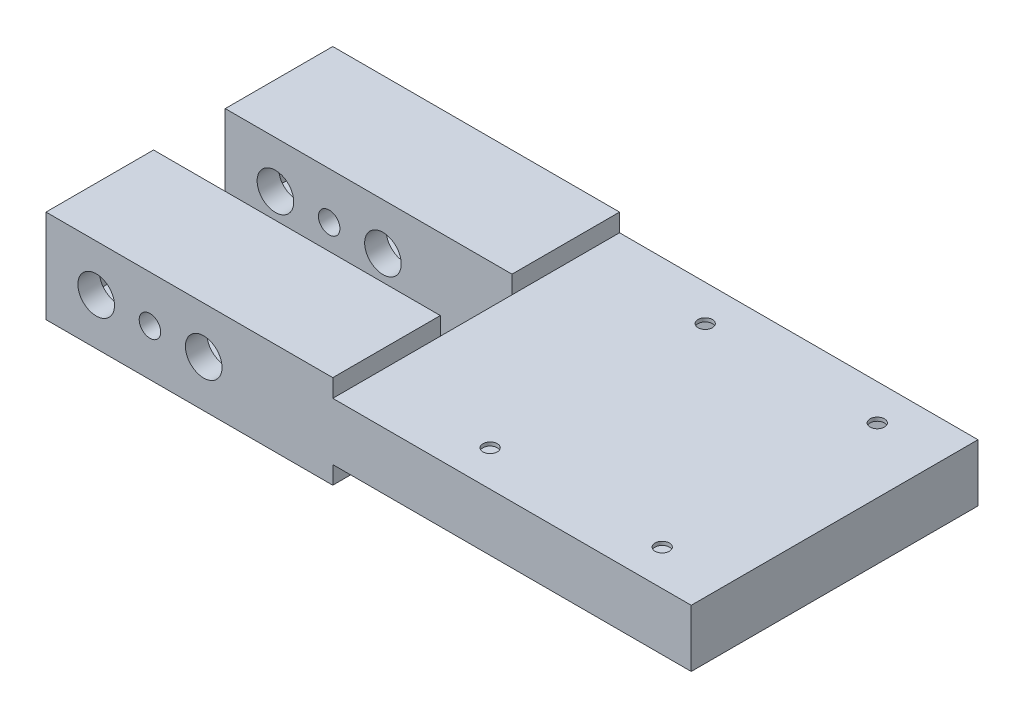
from build123d import *

# Parameters (mm, degrees)
BOSS_EXTRUDE1_DEPTH             = 5
BOSS_EXTRUDE1_DEPTH_BACK        = 5
SHELL1_T                        = -3
BOSS_EXTRUDE2_START             = 5
BOSS_EXTRUDE2_DEPTH             = 3
SKETCH2_R                       = 1.5
CUT_EXTRUDE1_DEPTH              = 100
SKETCH9_W                       = 40
SKETCH9_H                       = 2.5
CUT_EXTRUDE2_DEPTH              = 77.739820172
SKETCH10_W                      = 10
SKETCH10_H                      = 40
CUT_EXTRUDE3_DEPTH              = 2.5
CUT_EXTRUDE4_START              = -10.5
SKETCH10_2_W                    = 10
SKETCH10_2_H                    = 40
CUT_EXTRUDE4_DEPTH              = 2.5
F_2_0MM_CLEARANCE_DOWEL_HOLE2_D = 2
F_1_4_20_TAPPED_HOLE1_D         = 5.1054


with BuildPart() as part:
    # Sketch1 → Boss-Extrude1 (new, two sides: drawn at the far end of the back side and taken through both)
    with BuildSketch(Plane(origin=(0, 0, 0), x_dir=(1, 0, 0), z_dir=(0, 1, 0)).offset(-BOSS_EXTRUDE1_DEPTH_BACK)):
        Polygon((15, -5), (-25, -5), (-25, -20), (25, -20), (65, -20), (65, 20), (25, 20), (-25, 20), (-25, 5), (15, 5), align=None)
    extrude(amount=BOSS_EXTRUDE1_DEPTH + BOSS_EXTRUDE1_DEPTH_BACK)

    # Shell1
    shell1_openings = [part.faces().sort_by_distance(p)[0] for p in [
        (23.125, 5, 0),
    ]]
    offset(amount=SHELL1_T, openings=shell1_openings, kind=Kind.INTERSECTION)

    # Sketch1<2> → Boss-Extrude2 (add)
    with BuildSketch(Plane(origin=(0, 0, 0), x_dir=(1, 0, 0), z_dir=(0, 1, 0)).offset(BOSS_EXTRUDE2_START)):
        Polygon((15, -5), (-25, -5), (-25, -20), (25, -20), (65, -20), (65, 20), (25, 20), (-25, 20), (-25, 5), (15, 5), align=None)
    extrude(amount=BOSS_EXTRUDE2_DEPTH)

    # Sketch2 → Cut-Extrude1 (cut)
    with BuildSketch(Plane.XY.offset(20)):
        with Locations((-10.5, 1.5)):
            Circle(SKETCH2_R)
    extrude(amount=-CUT_EXTRUDE1_DEPTH, mode=Mode.SUBTRACT)

    # Sketch9 → Cut-Extrude2 (cut, through all)
    with BuildSketch(Plane.XY.offset(20)):
        with Locations((45, 6.75)):
            Rectangle(SKETCH9_W, SKETCH9_H)
        with Locations((45, -3.75)):
            Rectangle(SKETCH9_W, SKETCH9_H)
    extrude(amount=-CUT_EXTRUDE2_DEPTH, mode=Mode.SUBTRACT)

    # Sketch10 → Cut-Extrude3 (cut)
    with BuildSketch(Plane(origin=(0, 8, 0), x_dir=(1, 0, 0), z_dir=(0, 1, 0))):
        with Locations((20, 0)):
            Rectangle(SKETCH10_W, SKETCH10_H)
    extrude(amount=-CUT_EXTRUDE3_DEPTH, mode=Mode.SUBTRACT)

    # Sketch10<2> → Cut-Extrude4 (cut)
    with BuildSketch(Plane(origin=(0, 8, 0), x_dir=(1, 0, 0), z_dir=(0, 1, 0)).offset(CUT_EXTRUDE4_START)):
        with Locations((20, 0)):
            Rectangle(SKETCH10_2_W, SKETCH10_2_H)
    extrude(amount=-CUT_EXTRUDE4_DEPTH, mode=Mode.SUBTRACT)

    # Ø2.0mm Clearance Dowel Hole2 (through all)
    with Locations(Plane(origin=(0, 5.5, 0), x_dir=(1, 0, 0), z_dir=(0, 1, 0))):
        with Locations((31.950000364, 15), (31.950000364, -15), (55.950000364, -15), (55.950000364, 15)):
            Hole(F_2_0MM_CLEARANCE_DOWEL_HOLE2_D / 2)

    # 1/4-20 Tapped Hole1 (through all)
    with Locations(Plane.XY.offset(20)):
        with Locations((-18, 1.5), (-3, 1.5)):
            Hole(F_1_4_20_TAPPED_HOLE1_D / 2)


solid = part.part
